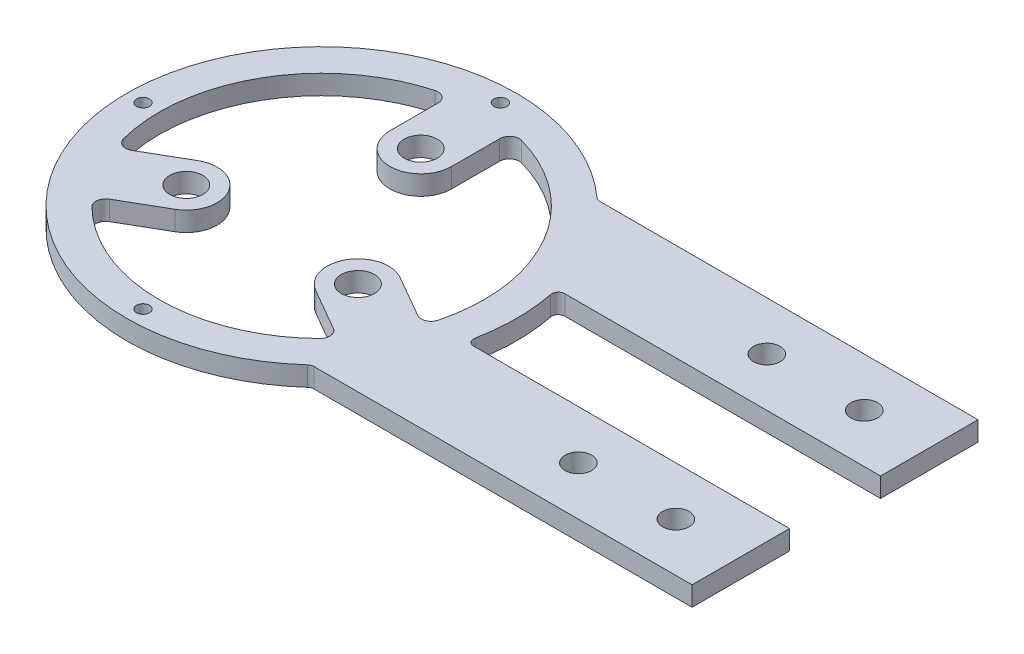
from build123d import *

# Parameters (mm, degrees)
SKETCH1_R           = 30
SKETCH1_R_2         = 25
BOSS_EXTRUDE1_DEPTH = 3
BOSS_EXTRUDE2_START = -3
SKETCH2_R           = 2.55
BOSS_EXTRUDE2_DEPTH = 3
CIRPATTERN1_COUNT   = 3
FILLET1_R           = 1.5
BOSS_EXTRUDE3_START = -3
BOSS_EXTRUDE3_DEPTH = 3
SKETCH4_R           = 2.05
CUT_EXTRUDE1_DEPTH  = 85.557672626
SKETCH5_R           = 1
CUT_EXTRUDE2_DEPTH  = 85.557672626
FILLET2_R           = 1


with BuildPart() as part:
    # Sketch1 → Boss-Extrude1 (new body)
    with BuildSketch(Plane(origin=(0, 0, 0), x_dir=(1, 0, 0), z_dir=(0, 1, 0))):
        with Locations(Location((0, 0, 0), (0, 0, 270))):
            Circle(SKETCH1_R)
        with Locations(Location((0, 0, 0), (0, 0, 270))):
            Circle(SKETCH1_R_2, mode=Mode.SUBTRACT)
    extrude(amount=BOSS_EXTRUDE1_DEPTH)

    # Sketch2 → Boss-Extrude2 (add)
    with BuildSketch(Plane(origin=(0, 3, 0), x_dir=(1, 0, 0), z_dir=(0, 1, 0)).offset(BOSS_EXTRUDE2_START)):
        with BuildLine():
            Line((-4.75, 15.25), (-4.75, 24.544602258))
            ThreePointArc((-4.75, 24.544602258), (0, 25), (4.75, 24.544602258))
            Line((4.75, 24.544602258), (4.75, 15.25))
            ThreePointArc((4.75, 15.25), (0, 10.5), (-4.75, 15.25))
        make_face()
        with Locations(Location((0, 15.25, 0), (0, 0, 270))):
            Circle(SKETCH2_R, mode=Mode.SUBTRACT)
    boss_extrude2 = extrude(amount=BOSS_EXTRUDE2_DEPTH)

    # CirPattern1: Boss-Extrude2 ×3 about axis
    cirpattern1_axis = Axis((0, 0, 0), (0, 1, 0))
    for i in range(1, CIRPATTERN1_COUNT):
        add(boss_extrude2.rotate(cirpattern1_axis, i * 360 / CIRPATTERN1_COUNT))

    # Fillet1
    fillet1_edges = [part.edges().sort_by_distance(p)[0] for p in [
        (4.75, 1.5, -24.544602258),
        (-4.75, 1.5, -24.544602258),
        (18.881249081, 1.5, 16.385921797),
        (23.631249081, 1.5, 8.158680461),
        (-23.631249081, 1.5, 8.158680461),
        (-18.881249081, 1.5, 16.385921797),
    ]]
    fillet(fillet1_edges, radius=FILLET1_R)

    # Sketch3 → Boss-Extrude3 (add)
    with BuildSketch(Plane(origin=(0, 3, 0), x_dir=(1, 0, 0), z_dir=(0, 1, 0)).offset(BOSS_EXTRUDE3_START)):
        with BuildLine():
            Line((20.396078054, 22), (79, 22))
            Line((79, 22), (79, 7))
            Line((79, 7), (29.171904292, 7))
            ThreePointArc((29.171904292, 7), (25.893941733, 15.149382216), (20.396078054, 22))
        make_face()
        with BuildLine():
            Line((29.171904292, -7), (79, -7))
            Line((79, -7), (79, -22))
            Line((79, -22), (20.396078054, -22))
            ThreePointArc((20.396078054, -22), (25.893941733, -15.149382216), (29.171904292, -7))
        make_face()
    extrude(amount=BOSS_EXTRUDE3_DEPTH)

    # Sketch4 → Cut-Extrude1 (cut, through all)
    with BuildSketch(Plane(origin=(0, 3, 0), x_dir=(1, 0, 0), z_dir=(0, 1, 0))):
        with Locations(Location((54, 14.5, 0), (0, 0, 270))):
            Circle(SKETCH4_R)
        with Locations(Location((69, 14.5, 0), (0, 0, 270))):
            Circle(SKETCH4_R)
        with Locations(Location((54, -14.5, 0), (0, 0, 270))):
            Circle(SKETCH4_R)
        with Locations(Location((69, -14.5, 0), (0, 0, 270))):
            Circle(SKETCH4_R)
    extrude(amount=-CUT_EXTRUDE1_DEPTH, mode=Mode.SUBTRACT)

    # Sketch5 → Cut-Extrude2 (cut, through all)
    with BuildSketch(Plane(origin=(0, 3, 0), x_dir=(1, 0, 0), z_dir=(0, 1, 0))):
        with Locations(Location((0, 27.5, 0), (0, 0, 270))):
            Circle(SKETCH5_R)
        with Locations(Location((-27.5, 0, 0), (0, 0, 270))):
            Circle(SKETCH5_R)
        with Locations(Location((0, -27.5, 0), (0, 0, 270))):
            Circle(SKETCH5_R)
    extrude(amount=-CUT_EXTRUDE2_DEPTH, mode=Mode.SUBTRACT)

    # Fillet2
    fillet2_edges = [part.edges().sort_by_distance(p)[0] for p in [
        (20.396078054, 1.5, 22),
        (29.171904292, 1.5, 7),
        (29.171904292, 1.5, -7),
        (20.396078054, 1.5, -22),
    ]]
    fillet(fillet2_edges, radius=FILLET2_R)


solid = part.part
